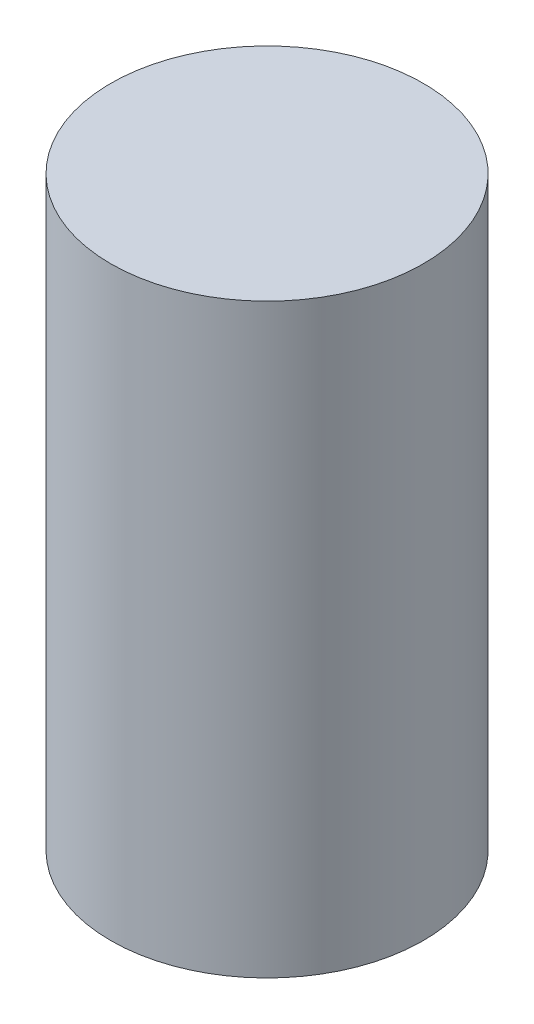
from build123d import *

# Parameters (mm, degrees)
SKETCH2_R           = 2
BOSS_EXTRUDE1_DEPTH = 7.5


with BuildPart() as part:
    # Sketch2 → Boss-Extrude1 (new body)
    with BuildSketch(Plane(origin=(0, 0, 0), x_dir=(1, 0, 0), z_dir=(0, 1, 0))):
        with Locations(Location((0, 0, 0), (0, 0, 270))):
            Circle(SKETCH2_R)
    extrude(amount=BOSS_EXTRUDE1_DEPTH)


solid = part.part
